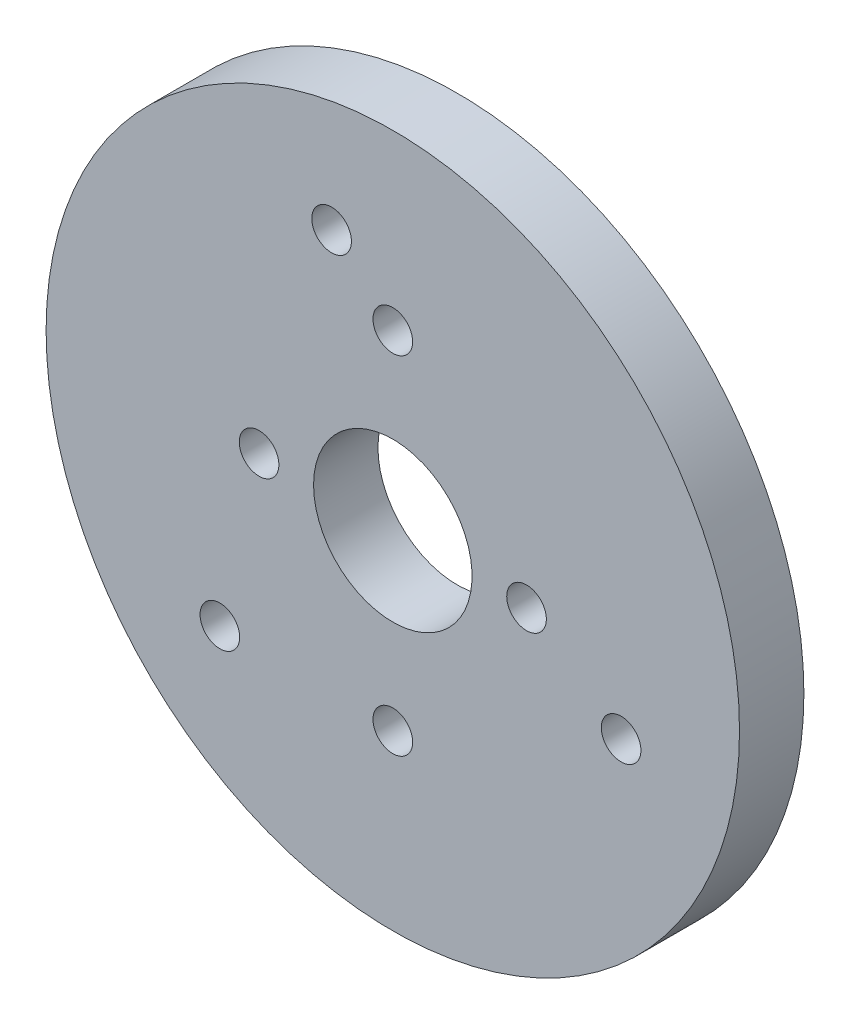
from build123d import *

# Parameters (mm, degrees)
SKETCH1_R           = 17.5
SKETCH1_R_2         = 4
SKETCH1_R_3         = 1
BOSS_EXTRUDE1_DEPTH = 3.25
SKETCH2_R           = 1
CUT_EXTRUDE1_DEPTH  = 25.961219922


with BuildPart() as part:
    # Sketch1 → Boss-Extrude1 (new body)
    with BuildSketch(Plane.XY):
        with Locations(Location((0, 0, 0), (0, 0, 180))):
            Circle(SKETCH1_R)
        with Locations(Location((0, 0, 0), (0, 0, 180))):
            Circle(SKETCH1_R_2, mode=Mode.SUBTRACT)
        with Locations(Location((6.75, 0, 0), (0, 0, 180))):
            Circle(SKETCH1_R_3, mode=Mode.SUBTRACT)
        with Locations(Location((0, 8.75, 0), (0, 0, 180))):
            Circle(SKETCH1_R_3, mode=Mode.SUBTRACT)
        with Locations(Location((0, -8.75, 0), (0, 0, 180))):
            Circle(SKETCH1_R_3, mode=Mode.SUBTRACT)
        with Locations(Location((-6.75, 0, 0), (0, 0, 180))):
            Circle(SKETCH1_R_3, mode=Mode.SUBTRACT)
    extrude(amount=BOSS_EXTRUDE1_DEPTH)

    # Sketch2 → Cut-Extrude1 (cut, through all)
    with BuildSketch(Plane.XY.offset(3.25)):
        with Locations((11.522732664, -3.350616653)):
            Circle(SKETCH2_R)
        with Locations((-8.729040356, -8.530488981)):
            Circle(SKETCH2_R)
        with Locations((-3.08905487, 11.59799709)):
            Circle(SKETCH2_R)
    extrude(amount=-CUT_EXTRUDE1_DEPTH, mode=Mode.SUBTRACT)


solid = part.part
